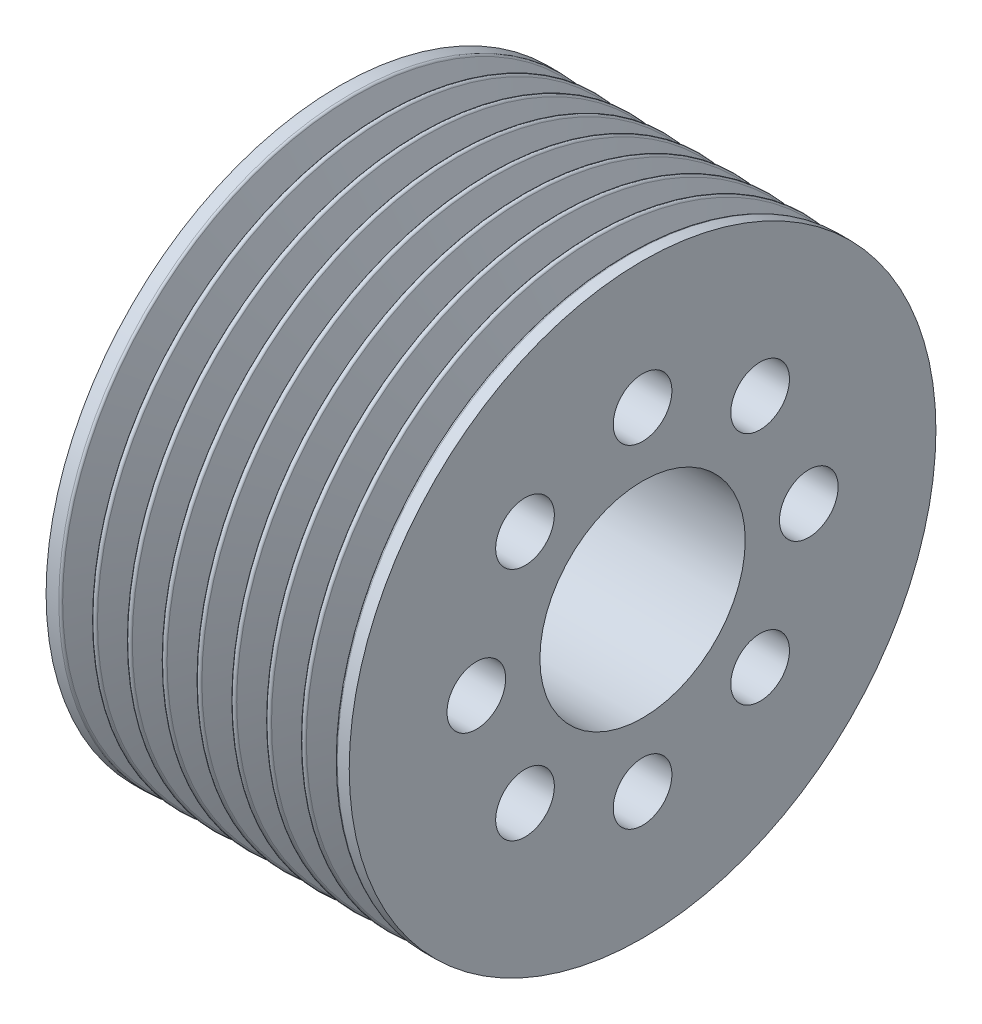
from build123d import *

# Parameters (mm, degrees)
LPATTERN1_COUNT    = 8
LPATTERN1_PITCH    = 3.56
SKETCH3_R          = 3
CUT_EXTRUDE1_DEPTH = 17.5


with BuildPart() as part:
    # Sketch1 → Revolve1 (revolve)
    with BuildSketch(Plane.XY, mode=Mode.PRIVATE) as revolve1_sk:
        Polygon((49, 10.5), (49, 30), (18, 30), (18, 21.5), (31.5, 21.5), (31.5, 10.5), align=None)
    revolve(revolve1_sk.sketch.rotate(Axis((0, 0, 0), (1, 0, 0)), 90), axis=Axis((0, 0, 0), (1, 0, 0)))

    # Sketch2 → Cut-Revolve1 (revolve, cut)
    with BuildSketch(Plane.XY, mode=Mode.PRIVATE) as cut_revolve1_sk:
        with BuildLine():
            Line((47.545831953, 29.837551845), (46.281001657, 26.45460955))
            ThreePointArc((46.281001657, 26.45460955), (46, 26.259671764), (45.718998343, 26.45460955))
            Line((45.718998343, 26.45460955), (44.454168047, 29.837551845))
            ThreePointArc((44.454168047, 29.837551845), (44.362499191, 29.955411734), (44.22, 30))
            Line((44.22, 30), (47.78, 30))
            ThreePointArc((47.78, 30), (47.637500809, 29.955411734), (47.545831953, 29.837551845))
        make_face()
    cut_revolve1 = revolve(cut_revolve1_sk.sketch.rotate(Axis((0, 0, 0), (1, 0, 0)), 90), axis=Axis((0, 0, 0), (1, 0, 0)), mode=Mode.SUBTRACT)

    # LPattern1: Cut-Revolve1 ×8
    with Locations(*[(-i * LPATTERN1_PITCH, 0, 0) for i in range(1, LPATTERN1_COUNT)]):
        add(cut_revolve1, mode=Mode.SUBTRACT)

    # Sketch3 → Cut-Extrude1 (cut)
    with BuildSketch(Plane(origin=(49, 0, 0), x_dir=(0, 0, -1), z_dir=(1, 0, 0))):
        with Locations((0, 17)):
            Circle(SKETCH3_R)
        with Locations((12.02081528, 12.02081528)):
            Circle(SKETCH3_R)
        with Locations((17, 0)):
            Circle(SKETCH3_R)
        with Locations((12.02081528, -12.02081528)):
            Circle(SKETCH3_R)
        with Locations((0, -17)):
            Circle(SKETCH3_R)
        with Locations((-12.02081528, -12.02081528)):
            Circle(SKETCH3_R)
        with Locations((-17, 0)):
            Circle(SKETCH3_R)
        with Locations((-12.02081528, 12.02081528)):
            Circle(SKETCH3_R)
    extrude(amount=-CUT_EXTRUDE1_DEPTH, mode=Mode.SUBTRACT)


solid = part.part
